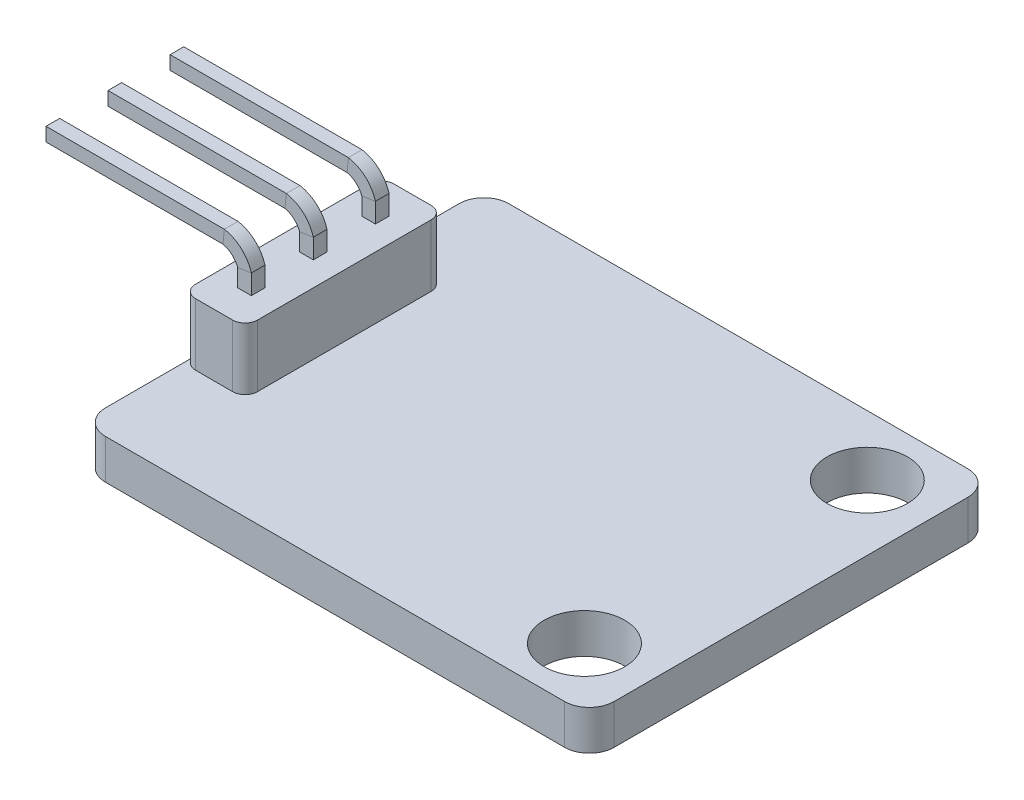
from build123d import *

# Parameters (mm, degrees)
SKETCH1_W           = 20.5
SKETCH1_H           = 16.25
SKETCH1_R           = 1.625
BOSS_EXTRUDE1_DEPTH = 1.6
FILLET1_R           = 1
SKETCH2_W           = 2.5
SKETCH2_H           = 8
BOSS_EXTRUDE2_DEPTH = 2.5
FILLET2_R           = 0.5
SKETCH8_W           = 0.55
SKETCH8_H           = 0.55
SKETCH9_W           = 0.55
SKETCH9_H           = 0.55
SKETCH4_W           = 0.55
SKETCH4_H           = 0.55


with BuildPart() as part:
    # Sketch1 → Boss-Extrude1 (new body)
    with BuildSketch(Plane(origin=(0, 0, 0), x_dir=(1, 0, 0), z_dir=(0, 1, 0))):
        Rectangle(SKETCH1_W, SKETCH1_H)
        with Locations(Location((7.625, 5.7, 0), (0, 0, 270))):
            Circle(SKETCH1_R, mode=Mode.SUBTRACT)
        with Locations(Location((7.625, -5.7, 0), (0, 0, 90))):
            Circle(SKETCH1_R, mode=Mode.SUBTRACT)
    extrude(amount=BOSS_EXTRUDE1_DEPTH)

    # Fillet1
    fillet1_edges = [part.edges().sort_by_distance(p)[0] for p in [
        (10.25, 0.8, 8.125),
        (-10.25, 0.8, 8.125),
        (-10.25, 0.8, -8.125),
        (10.25, 0.8, -8.125),
    ]]
    fillet(fillet1_edges, radius=FILLET1_R)

    # Sketch2 → Boss-Extrude2 (add)
    with BuildSketch(Plane(origin=(0, 1.6, 0), x_dir=(1, 0, 0), z_dir=(0, 1, 0))):
        with Locations((-9, 0)):
            Rectangle(SKETCH2_W, SKETCH2_H)
    extrude(amount=BOSS_EXTRUDE2_DEPTH)

    # Fillet2
    fillet2_edges = [part.edges().sort_by_distance(p)[0] for p in [
        (-7.75, 2.85, 4),
        (-7.75, 2.85, -4),
        (-10.25, 2.85, -4),
        (-10.25, 2.85, 4),
    ]]
    fillet(fillet2_edges, radius=FILLET2_R)

    # Sweep2: sweep along a path in Sketch5
    with BuildLine(Plane.XY.offset(-2.5)) as sweep2_path:
        Line((-9, 4.1), (-9, 4.85))
        ThreePointArc((-9, 4.85), (-9.317041617, 5.34027213), (-9.839940826, 5.6))
        Line((-9.839940826, 5.6), (-17, 5.6))
    # Sketch8 → Sweep2 (sweep)
    with BuildSketch(Plane(origin=(0, 4.1, 0), x_dir=(1, 0, 0), z_dir=(0, 1, 0))):
        with Locations((-9.001105099, 2.502876889)):
            Rectangle(SKETCH8_W, SKETCH8_H)
    sweep(path=sweep2_path.line, transition=Transition.RIGHT)

    # Sweep3: sweep along a path in Sketch6
    with BuildLine(Plane.XY.offset(2.5)) as sweep3_path:
        Line((-9, 4.1), (-9, 4.85))
        ThreePointArc((-9, 4.85), (-9.317041617, 5.34027213), (-9.839940826, 5.6))
        Line((-9.839940826, 5.6), (-17, 5.6))
    # Sketch9 → Sweep3 (sweep)
    with BuildSketch(Plane(origin=(0, 4.1, 0), x_dir=(1, 0, 0), z_dir=(0, 1, 0))):
        with Locations((-8.999962547, -2.498553748)):
            Rectangle(SKETCH9_W, SKETCH9_H)
    sweep(path=sweep3_path.line, transition=Transition.RIGHT)

    # Sweep4: sweep along a path in Sketch3
    with BuildLine(Plane.XY) as sweep4_path:
        Line((-9, 4.1), (-9, 4.85))
        ThreePointArc((-9, 4.85), (-9.317041617, 5.34027213), (-9.839940826, 5.6))
        Line((-9.839940826, 5.6), (-17, 5.6))
    # Sketch4 → Sweep4 (sweep)
    with BuildSketch(Plane(origin=(0, 4.1, 0), x_dir=(1, 0, 0), z_dir=(0, 1, 0))):
        with Locations((-9, 0)):
            Rectangle(SKETCH4_W, SKETCH4_H)
    sweep(path=sweep4_path.line, transition=Transition.RIGHT)


solid = part.part
